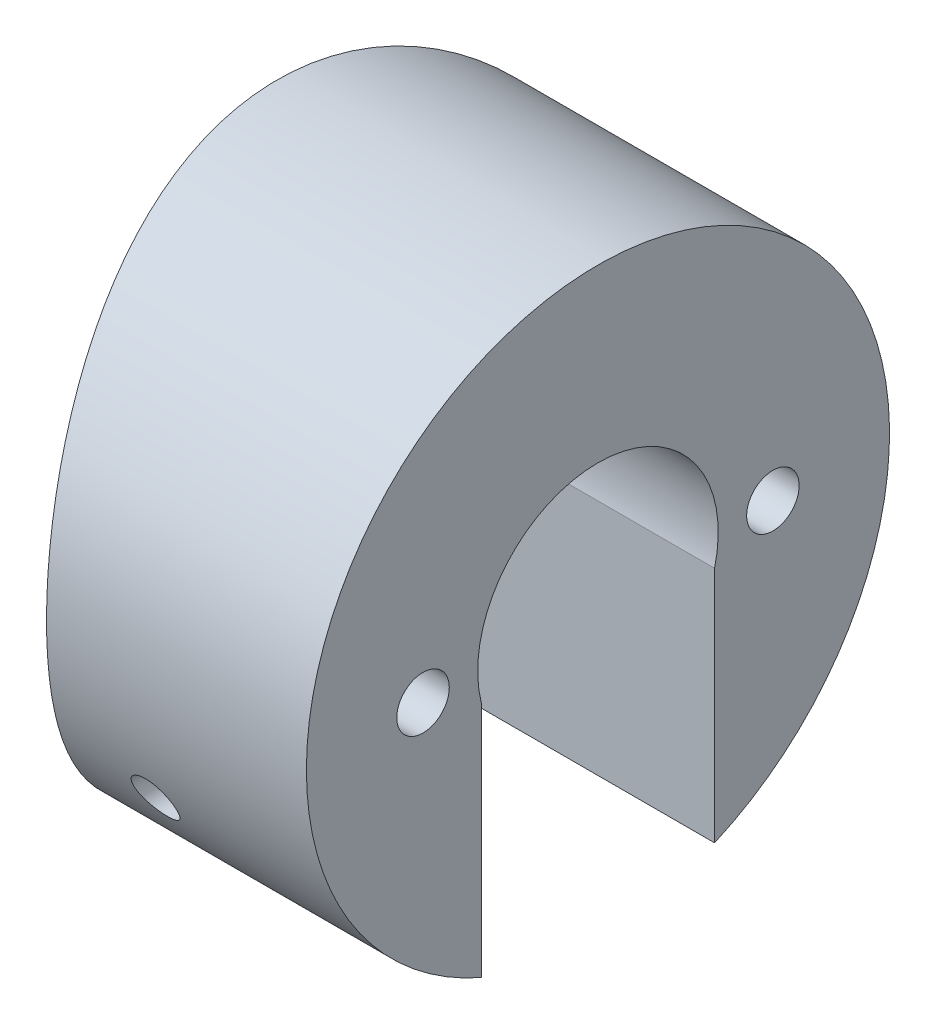
from build123d import *

# Parameters (mm, degrees)
SKETCH1_R                     = 20
BOSS_EXTRUDE1_DEPTH           = 22
CUT_EXTRUDE1_START            = -19
CUT_EXTRUDE1_DEPTH            = 19
CSK_FOR_M3_SFHCS1_D           = 3.6
CSK_FOR_M3_SFHCS1_CSINK_D     = 6.72
CSK_FOR_M3_SFHCS1_CSINK_ANGLE = 90
CUT_EXTRUDE2_START            = -20.001419
SKETCH7_R                     = 75
SKETCH7_R_2                   = 50
CUT_EXTRUDE2_DEPTH            = 40.002838
CUT_EXTRUDE3_REACH            = 37.833
CUT_EXTRUDE3_END_RADIUS       = 20
SKETCH8_R                     = 1.5


with BuildPart() as part:
    # Sketch1 → Boss-Extrude1 (new body)
    with BuildSketch(Plane(origin=(0, 0, 0), x_dir=(0, 0, -1), z_dir=(1, 0, 0))):
        Circle(SKETCH1_R)
    extrude(amount=BOSS_EXTRUDE1_DEPTH)

    # Sketch2 → Cut-Extrude1 (cut)
    with BuildSketch(Plane(origin=(22, 0, 0), x_dir=(0, 0, -1), z_dir=(1, 0, 0)).offset(CUT_EXTRUDE1_START)):
        with BuildLine():
            Line((-8, -18.33030278), (-8, -2.015564437))
            ThreePointArc((-8, -2.015564437), (0, 8.25), (8, -2.015564437))
            Line((8, -2.015564437), (8, -18.33030278))
            ThreePointArc((8, -18.33030278), (0, -20), (-8, -18.33030278))
        make_face()
    extrude(amount=CUT_EXTRUDE1_DEPTH, mode=Mode.SUBTRACT)

    # CSK for M3 SFHCS1 (through all)
    with Locations(Plane.ZY):
        with Locations((-12, 0), (12, 0)):
            CounterSinkHole(CSK_FOR_M3_SFHCS1_D / 2, CSK_FOR_M3_SFHCS1_CSINK_D / 2, counter_sink_angle=CSK_FOR_M3_SFHCS1_CSINK_ANGLE)

    # Sketch7 → Cut-Extrude2 (cut)
    with BuildSketch(Plane(origin=(0, 0, 0), x_dir=(1, 0, 0), z_dir=(0, 1, 0)).offset(CUT_EXTRUDE2_START)):
        with Locations((50, 0)):
            Circle(SKETCH7_R)
        with Locations((50, 0)):
            Circle(SKETCH7_R_2, mode=Mode.SUBTRACT)
    extrude(amount=CUT_EXTRUDE2_DEPTH, mode=Mode.SUBTRACT)

    # Cut-Extrude3: up to this cylinder (the profile starts inside it)
    cut_extrude3_end = Plane(origin=(9.5, 0, 0), z_dir=(-1, 0, 0)) * Cylinder(CUT_EXTRUDE3_END_RADIUS, 116.666, mode=Mode.PRIVATE)
    # Sketch8 → Cut-Extrude3 (cut, up to the surface)
    with BuildSketch(Plane.XY, mode=Mode.PRIVATE) as cut_extrude3_sk1:
        with Locations(Location((9.5, -9, 0), (0, 0, 180))):
            Circle(SKETCH8_R)
    cut_extrude3_tool1 = extrude(cut_extrude3_sk1.sketch, amount=CUT_EXTRUDE3_REACH, mode=Mode.PRIVATE) & cut_extrude3_end
    add(cut_extrude3_tool1.solids().sort_by_distance((9.5, -9, 0))[0], mode=Mode.SUBTRACT)


solid = part.part
